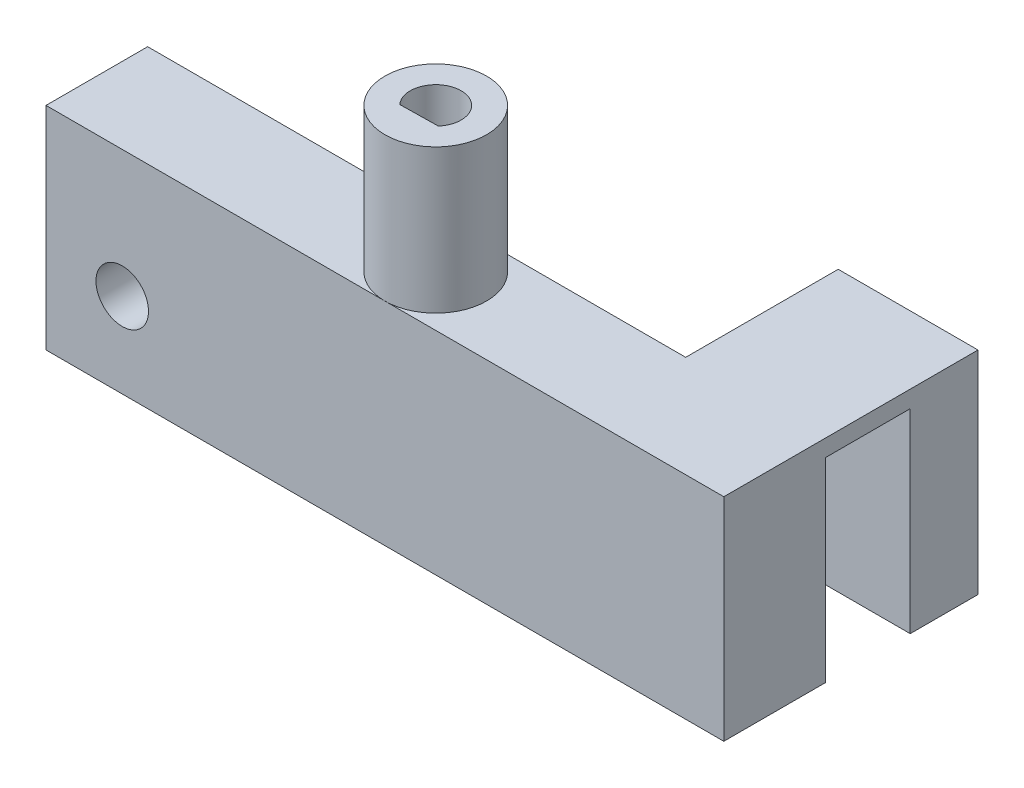
from build123d import *

# Parameters (mm, degrees)
SKETCH1_R           = 3
BOSS_EXTRUDE1_DEPTH = 8.5
CUT_EXTRUDE1_DEPTH  = 6
SKETCH3_W           = 40
SKETCH3_H           = 6
BOSS_EXTRUDE2_DEPTH = 12.5
SKETCH4_R           = 1.55
CUT_EXTRUDE2_DEPTH  = 25.336187047
SKETCH6_W           = 8.25
SKETCH6_H           = 12.5
BOSS_EXTRUDE3_DEPTH = 9
SKETCH7_W           = 8.25
SKETCH7_H           = 5
CUT_EXTRUDE3_DEPTH  = 11.5


with BuildPart() as part:
    # Sketch1 → Boss-Extrude1 (new body)
    with BuildSketch(Plane(origin=(0, 0, 0), x_dir=(1, 0, 0), z_dir=(0, 1, 0))):
        with Locations(Location((0, 0, 0), (0, 0, 270))):
            Circle(SKETCH1_R)
    extrude(amount=BOSS_EXTRUDE1_DEPTH)

    # Sketch2 → Cut-Extrude1 (cut)
    with BuildSketch(Plane(origin=(0, 8.5, 0), x_dir=(1, 0, 0), z_dir=(0, 1, 0))):
        with BuildLine():
            Line((-1.101332519, -1.01836471), (1.134429265, -0.981361423))
            ThreePointArc((1.134429265, -0.981361423), (-0.02482256, 1.499794599), (-1.101332519, -1.01836471))
        make_face()
    extrude(amount=-CUT_EXTRUDE1_DEPTH, mode=Mode.SUBTRACT)

    # Sketch3 → Boss-Extrude2 (add)
    with BuildSketch(Plane.XZ):
        Rectangle(SKETCH3_W, SKETCH3_H)
    extrude(amount=BOSS_EXTRUDE2_DEPTH)

    # Sketch4 → Cut-Extrude2 (cut, through all)
    with BuildSketch(Plane(origin=(0, 0, -3), x_dir=(-1, 0, 0), z_dir=(0, 0, -1))):
        with Locations((15.5, -7.5)):
            Circle(SKETCH4_R)
    extrude(amount=-CUT_EXTRUDE2_DEPTH, mode=Mode.SUBTRACT)

    # Sketch6 → Boss-Extrude3 (add)
    with BuildSketch(Plane(origin=(0, 0, -3), x_dir=(-1, 0, 0), z_dir=(0, 0, -1))):
        with Locations((-15.875, -6.25)):
            Rectangle(SKETCH6_W, SKETCH6_H)
    extrude(amount=BOSS_EXTRUDE3_DEPTH)

    # Sketch7 → Cut-Extrude3 (cut)
    with BuildSketch(Plane.XZ.offset(12.5)):
        with Locations((15.875, -5.5)):
            Rectangle(SKETCH7_W, SKETCH7_H)
    extrude(amount=-CUT_EXTRUDE3_DEPTH, mode=Mode.SUBTRACT)


solid = part.part
